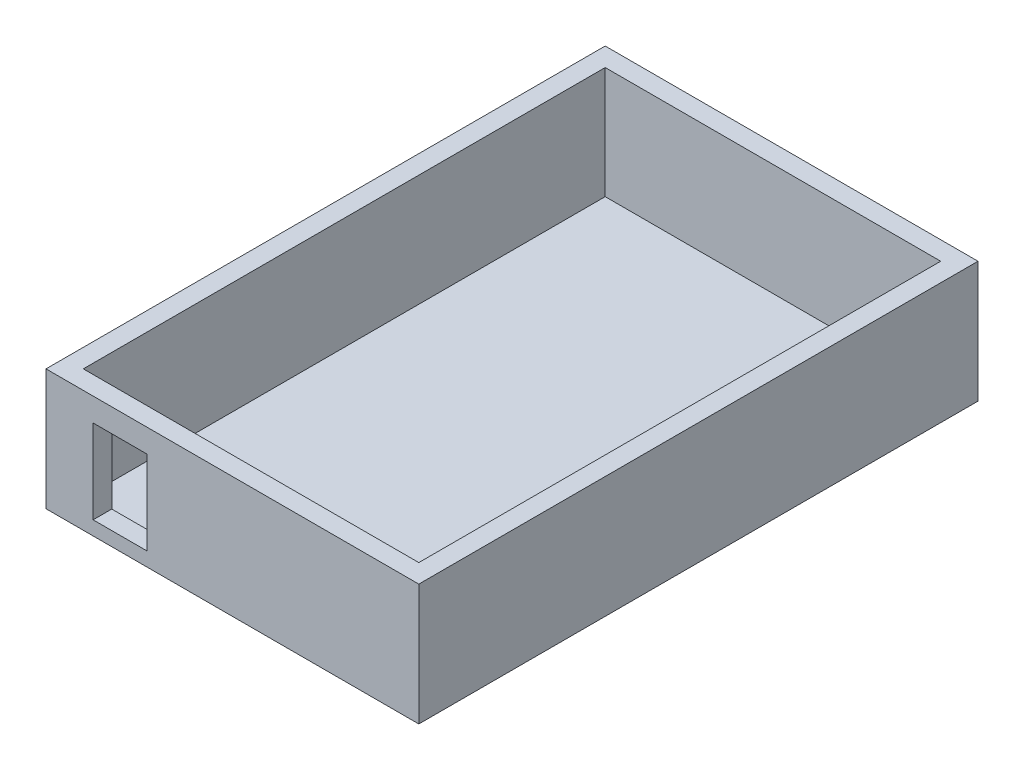
from build123d import *

# Parameters (mm, degrees)
SKETCH1_W          = 10000
SKETCH1_H          = 15000
BASE_DEPTH         = 250
SKETCH3_W          = 10000
SKETCH3_H          = 500
WALL_1_DEPTH       = 3000
SKETCH4_W          = 500
SKETCH4_H          = 14000
WALL_2_DEPTH       = 3000
SKETCH5_W          = 500
SKETCH5_H          = 14000
WALL_3_DEPTH       = 3000
SKETCH6_W          = 10000
SKETCH6_H          = 500
WALL_4_DEPTH       = 3000
SKETCH8_W          = 1447.785248023
SKETCH8_H          = 2250
CUT_EXTRUDE1_DEPTH = 2000


with BuildPart() as part:
    # Sketch1 → Base (new body)
    with BuildSketch(Plane(origin=(0, 0, 0), x_dir=(1, 0, 0), z_dir=(0, 1, 0))):
        with Locations((-4899.833055092, 7442.404006678)):
            Rectangle(SKETCH1_W, SKETCH1_H)
    extrude(amount=BASE_DEPTH)

    # Sketch3 → Wall_1 (add)
    with BuildSketch(Plane(origin=(0, 250, 0), x_dir=(1, 0, 0), z_dir=(0, 1, 0))):
        with Locations((-4899.833055092, 192.404006678)):
            Rectangle(SKETCH3_W, SKETCH3_H)
    extrude(amount=WALL_1_DEPTH)

    # Sketch4 → Wall_2 (add)
    with BuildSketch(Plane(origin=(0, 250, 0), x_dir=(1, 0, 0), z_dir=(0, 1, 0))):
        with Locations((-9649.833055092, 7442.404006678)):
            Rectangle(SKETCH4_W, SKETCH4_H)
    extrude(amount=WALL_2_DEPTH)

    # Sketch5 → Wall_3 (add)
    with BuildSketch(Plane(origin=(0, 250, 0), x_dir=(1, 0, 0), z_dir=(0, 1, 0))):
        with Locations((-149.833055092, 7442.404006678)):
            Rectangle(SKETCH5_W, SKETCH5_H)
    extrude(amount=WALL_3_DEPTH)

    # Sketch6 → Wall_4 (add)
    with BuildSketch(Plane(origin=(0, 250, 0), x_dir=(1, 0, 0), z_dir=(0, 1, 0))):
        with Locations((-4899.833055092, 14692.404006678)):
            Rectangle(SKETCH6_W, SKETCH6_H)
    extrude(amount=WALL_4_DEPTH)

    # Sketch8 → Cut-Extrude1 (cut)
    with BuildSketch(Plane.XY.offset(57.595993322)):
        with Locations((-7912.16042598, 1500)):
            Rectangle(SKETCH8_W, SKETCH8_H)
    extrude(amount=-CUT_EXTRUDE1_DEPTH, mode=Mode.SUBTRACT)


solid = part.part
